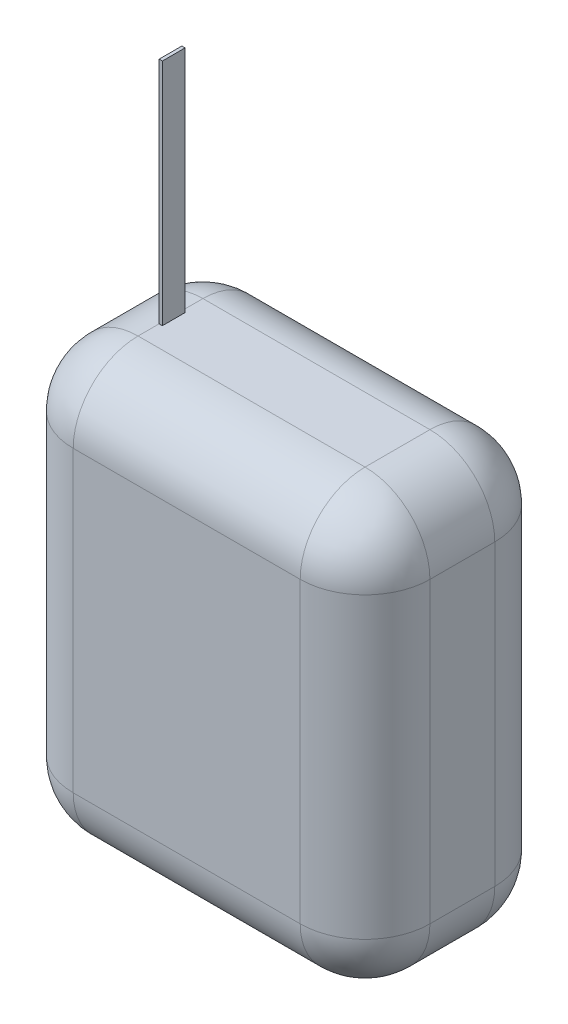
from build123d import *

# Parameters (mm, degrees)
SKETCH_1_W      = 55
SKETCH_1_H      = 66
EXTRUDE_1_DEPTH = 30
FILLET_1_R      = 10
SKETCH_2_W      = 0.5
SKETCH_2_H      = 35.350562887
EXTRUDE_2_DEPTH = 0.5
SKETCH_2_4_W    = 0.5
SKETCH_2_4_H    = 35.350562887
EXTRUDE_4_DEPTH = 0.5
SKETCH_2_5_W    = 0.5
SKETCH_2_5_H    = 35.350562887
EXTRUDE_5_DEPTH = 0.5
SKETCH_2_6_W    = 0.5
SKETCH_2_6_H    = 35.350562887
EXTRUDE_6_DEPTH = 0.5
SKETCH_2_7_W    = 1.5
SKETCH_2_7_H    = 35.350562887
EXTRUDE_7_DEPTH = 0.5


with BuildPart() as part:
    # 草图1 → 凸台-拉伸1 (new body)
    with BuildSketch(Plane.XY):
        Rectangle(SKETCH_1_W, SKETCH_1_H)
    extrude(amount=EXTRUDE_1_DEPTH)

    # 圆角1
    fillet_1_edges = [part.edges().sort_by_distance(p)[0] for p in [
        (27.5, 0, 30),
        (0, -33, 30),
        (27.5, -33, 15),
        (0, -33, 0),
        (27.5, 0, 0),
        (-27.5, 0, 30),
        (-27.5, -33, 15),
        (-27.5, 0, 0),
        (27.5, 33, 15),
        (0, 33, 30),
        (-27.5, 33, 15),
        (0, 33, 0),
    ]]
    fillet(fillet_1_edges, radius=FILLET_1_R)

    # 草图2 → 凸台-拉伸2 (add)
    with BuildSketch(Plane.ZY.offset(17.5)):
        with Locations((13.5, 50.675281444)):
            Rectangle(SKETCH_2_W, SKETCH_2_H)
    extrude(amount=-EXTRUDE_2_DEPTH)

    # 草图2<4> → 凸台-拉伸4 (add)
    with BuildSketch(Plane.ZY.offset(17.5)):
        with Locations((14, 50.675281444)):
            Rectangle(SKETCH_2_4_W, SKETCH_2_4_H)
    extrude(amount=-EXTRUDE_4_DEPTH)

    # 草图2<5> → 凸台-拉伸5 (add)
    with BuildSketch(Plane.ZY.offset(17.5)):
        with Locations((15, 50.675281444)):
            Rectangle(SKETCH_2_5_W, SKETCH_2_5_H)
    extrude(amount=-EXTRUDE_5_DEPTH)

    # 草图2<6> → 凸台-拉伸6 (add)
    with BuildSketch(Plane.ZY.offset(17.5)):
        with Locations((14.5, 50.675281444)):
            Rectangle(SKETCH_2_6_W, SKETCH_2_6_H)
    extrude(amount=-EXTRUDE_6_DEPTH)

    # 草图2<7> → 凸台-拉伸7 (add)
    with BuildSketch(Plane.ZY.offset(17.5)):
        with Locations((16, 50.675281444)):
            Rectangle(SKETCH_2_7_W, SKETCH_2_7_H)
    extrude(amount=-EXTRUDE_7_DEPTH)


solid = part.part
